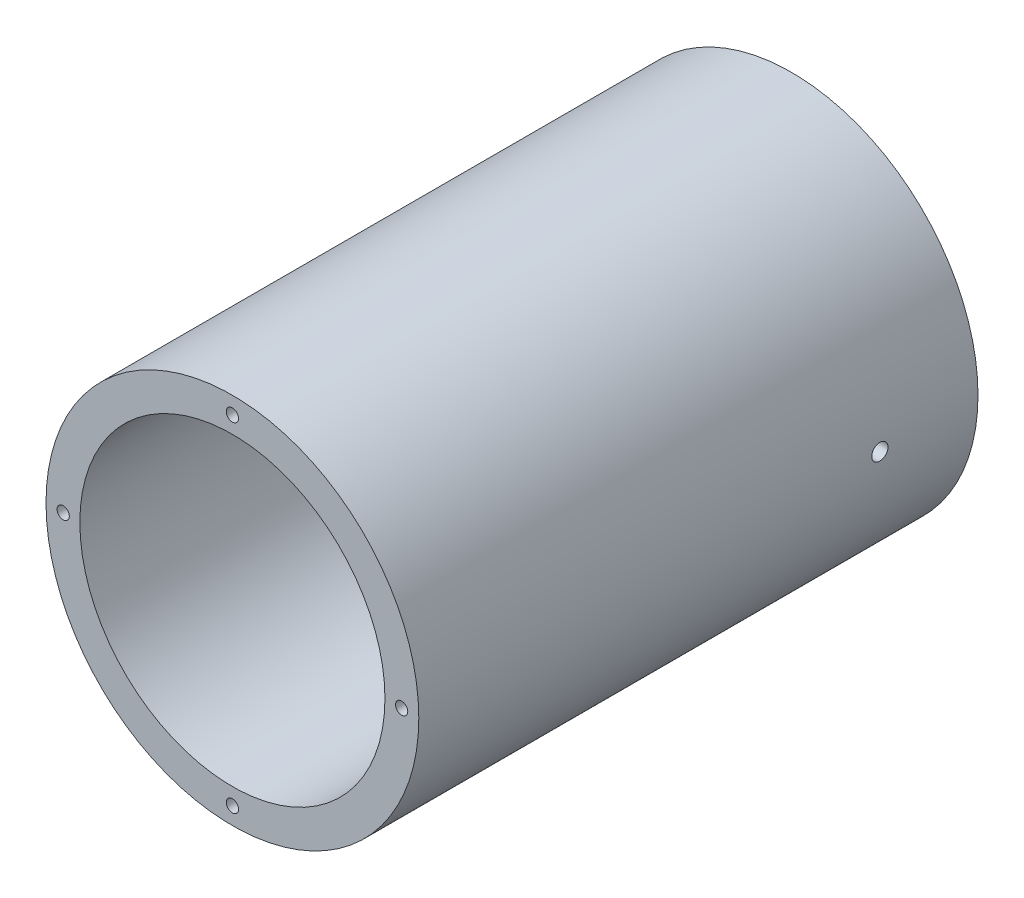
from build123d import *

# Parameters (mm, degrees)
SKETCH_1_R                   = 38
SKETCH_1_R_2                 = 31.1
EXTRUDE_1_DEPTH              = 57
HOLE_WIZARD_M3_1_D           = 2.5
HOLE_WIZARD_M3_1_DEPTH       = 8.5
HOLE_WIZARD_M3_1_TIP         = 0.751075774
HOLE_WIZARD_M3_3_D           = 2.5
HOLE_WIZARD_M3_3_DEPTH       = 8.5
HOLE_WIZARD_M3_3_TIP         = 0.751075774
HOLE_WIZARD_M4_1_D           = 3.3
HOLE_WIZARD_M4_1_ON_FACE_2_D = 3.3


with BuildPart() as part:
    # 草图1 → 凸台-拉伸1 (new, symmetric)
    with BuildSketch(Plane.XY):
        with Locations(Location((0, 0, 0), (0, 0, 180))):
            Circle(SKETCH_1_R)
        with Locations(Location((0, 0, 0), (0, 0, 180))):
            Circle(SKETCH_1_R_2, mode=Mode.SUBTRACT)
    extrude(amount=EXTRUDE_1_DEPTH, both=True)

    # M3 螺纹孔1
    with Locations(Plane.XY.offset(57)):
        with Locations((0, 34.5), (34.5, 0), (0, -34.5), (-34.5, 0)):
            Hole(HOLE_WIZARD_M3_1_D / 2, depth=HOLE_WIZARD_M3_1_DEPTH)
            with Locations((0, 0, -(HOLE_WIZARD_M3_1_DEPTH + HOLE_WIZARD_M3_1_TIP / 2))):  # 118° drill point
                Cone(0, HOLE_WIZARD_M3_1_D / 2, HOLE_WIZARD_M3_1_TIP, mode=Mode.SUBTRACT)

    # M3 螺纹孔3
    with Locations(Plane(origin=(13.806274772, 28.987165745, -57), x_dir=(-1, 0, 0), z_dir=(0, 0, -1))):
        with Locations((48.306274772, -28.987165745), (13.806274772, -63.487165745), (-20.693725228, -28.987165745), (13.806274772, 5.512834255)):
            Hole(HOLE_WIZARD_M3_3_D / 2, depth=HOLE_WIZARD_M3_3_DEPTH)
            with Locations((0, 0, -(HOLE_WIZARD_M3_3_DEPTH + HOLE_WIZARD_M3_3_TIP / 2))):  # 118° drill point
                Cone(0, HOLE_WIZARD_M3_3_D / 2, HOLE_WIZARD_M3_3_TIP, mode=Mode.SUBTRACT)

    # M4 螺纹孔1 (through all)
    with Locations(Plane(origin=(38, 0, -37), x_dir=(0, 1, 0), z_dir=(1, 0, 0))):
        with Locations((0, 0)):
            Hole(HOLE_WIZARD_M4_1_D / 2)

    # M4 螺纹孔1 on face 2 (through all)
    with Locations(Plane(origin=(-38, 0, -37), x_dir=(0, 0, -1), z_dir=(-1, 0, 0))):
        with Locations((0, 0)):
            Hole(HOLE_WIZARD_M4_1_ON_FACE_2_D / 2)


solid = part.part
